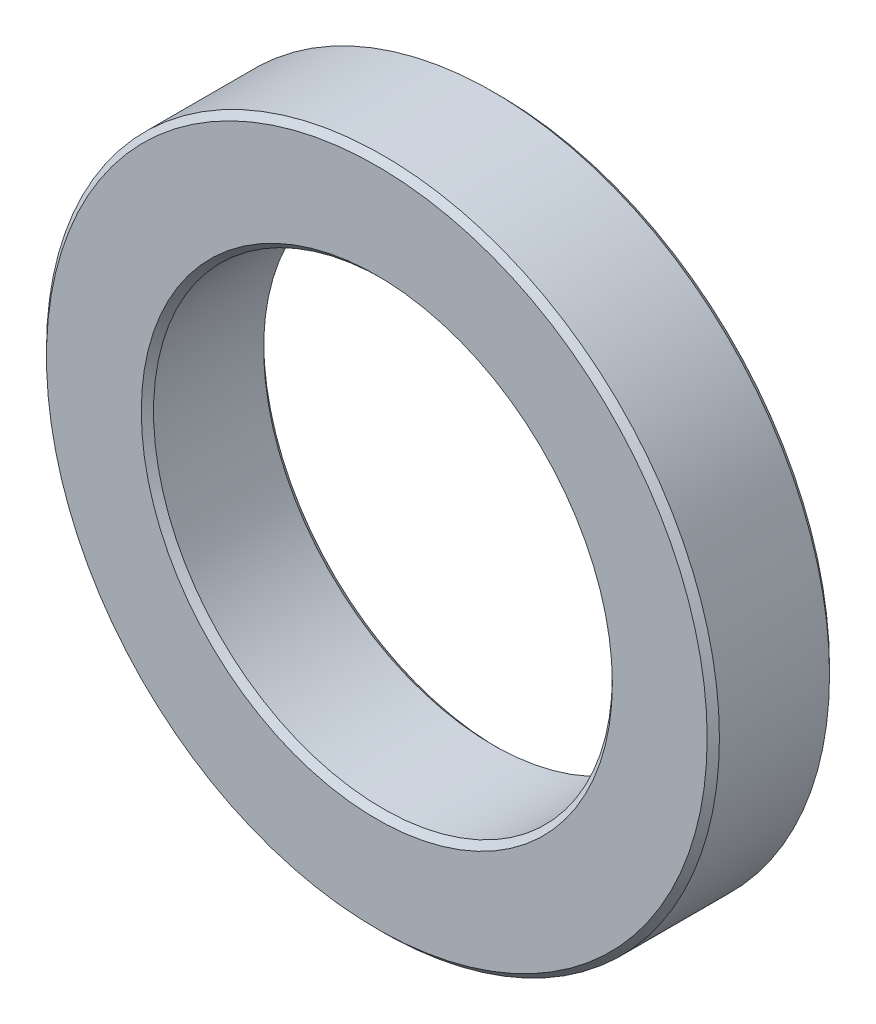
from build123d import *

# Parameters (mm, degrees)
SKETCH_1_R          = 11
SKETCH_1_R_2        = 1
EXTRUDE_1_DEPTH     = 4
EXTRUDE_START       = -12
SKETCH_3_R          = 1
EXTRUDE_2_DEPTH     = 12
SKETCH_12_R         = 1
CUT_EXTRUDE_4_DEPTH = 20
SKETCH_13_R         = 7.5
CUT_EXTRUDE_5_DEPTH = 17.062378404
EXTRUDE_START_2     = -1
SKETCH_14_R         = 1
EXTRUDE_3_DEPTH     = 1
CHAMFER_1_SIZE      = 0.2


with BuildPart() as part:
    # 草图1 → 凸台-拉伸1 (new body)
    with BuildSketch(Plane.XY):
        Circle(SKETCH_1_R)
        with Locations((9, 0)):
            Circle(SKETCH_1_R_2, mode=Mode.SUBTRACT)
        with Locations((2.781152949, -8.559508647)):
            Circle(SKETCH_1_R_2, mode=Mode.SUBTRACT)
        with Locations((-7.281152949, -5.290067271)):
            Circle(SKETCH_1_R_2, mode=Mode.SUBTRACT)
        with Locations((-7.281152949, 5.290067271)):
            Circle(SKETCH_1_R_2, mode=Mode.SUBTRACT)
        with Locations((2.781152949, 8.559508647)):
            Circle(SKETCH_1_R_2, mode=Mode.SUBTRACT)
    extrude(amount=EXTRUDE_1_DEPTH)

    # 草图3 → 凸台-拉伸2 (add)
    with BuildSketch(Plane.XY.offset(4).offset(EXTRUDE_START)):
        with Locations((9, 0)):
            Circle(SKETCH_3_R)
        with Locations((2.781152949, -8.559508647)):
            Circle(SKETCH_3_R)
        with Locations((-7.281152949, -5.290067271)):
            Circle(SKETCH_3_R)
        with Locations((-7.281152949, 5.290067271)):
            Circle(SKETCH_3_R)
        with Locations((2.781152949, 8.559508647)):
            Circle(SKETCH_3_R)
    extrude(amount=EXTRUDE_2_DEPTH)

    # 草图12 → 切除-拉伸4 (cut)
    with BuildSketch(Plane(origin=(0, 0, -8), x_dir=(-1, 0, 0), z_dir=(0, 0, -1))):
        with Locations(Location((-2.781152949, -8.559508647, 0), (0, 0, 180))):
            Circle(SKETCH_12_R)
        with Locations(Location((7.281152949, 5.290067271, 0), (0, 0, 180))):
            Circle(SKETCH_12_R)
        with Locations(Location((-2.781152949, 8.559508647, 0), (0, 0, 180))):
            Circle(SKETCH_12_R)
        with Locations(Location((-9, 0, 0), (0, 0, 180))):
            Circle(SKETCH_12_R)
        with Locations(Location((7.281152949, -5.290067271, 0), (0, 0, 180))):
            Circle(SKETCH_12_R)
    extrude(amount=-CUT_EXTRUDE_4_DEPTH, mode=Mode.SUBTRACT)

    # 草图13 → 切除-拉伸5 (cut, through all)
    with BuildSketch(Plane.XY.offset(4)):
        Circle(SKETCH_13_R)
    extrude(amount=-CUT_EXTRUDE_5_DEPTH, mode=Mode.SUBTRACT)

    # 草图14 → 凸台-拉伸3 (add)
    with BuildSketch(Plane.XY.offset(4).offset(EXTRUDE_START_2)):
        with Locations((-7.281152949, -5.290067271)):
            Circle(SKETCH_14_R)
        with Locations((2.781152949, -8.559508647)):
            Circle(SKETCH_14_R)
        with Locations((9, 0)):
            Circle(SKETCH_14_R)
        with Locations((2.781152949, 8.559508647)):
            Circle(SKETCH_14_R)
        with Locations((-7.281152949, 5.290067271)):
            Circle(SKETCH_14_R)
    extrude(amount=EXTRUDE_3_DEPTH)

    # 倒角1
    chamfer_1_edges = [part.edges().sort_by_distance(p)[0] for p in [
        (-11, 0, 0),
        (-11, 0, 4),
        (-7.5, 0, 0),
        (-7.5, 0, 4),
    ]]
    chamfer(chamfer_1_edges, length=CHAMFER_1_SIZE)


solid = part.part
